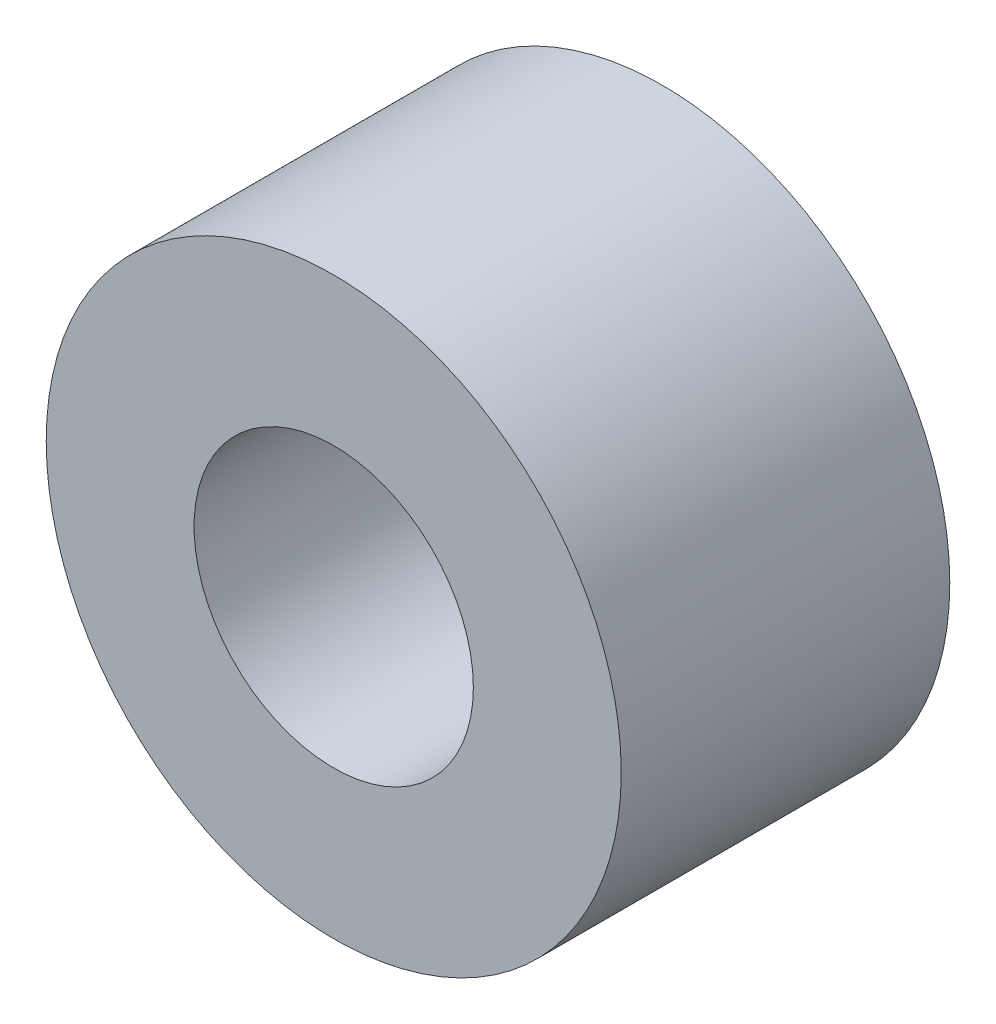
from build123d import *

# Parameters (mm, degrees)
PCB_INSULATION_SLEEVE_PROFILE_R   = 3.5
PCB_INSULATION_SLEEVE_PROFILE_R_2 = 1.7
PCB_INSULATION_SLEEVE_DEPTH       = 4


with BuildPart() as part:
    # PCB insulation sleeve profile → PCB insulation sleeve (new body)
    with BuildSketch(Plane.XY):
        Circle(PCB_INSULATION_SLEEVE_PROFILE_R)
        Circle(PCB_INSULATION_SLEEVE_PROFILE_R_2, mode=Mode.SUBTRACT)
    extrude(amount=PCB_INSULATION_SLEEVE_DEPTH)


solid = part.part
